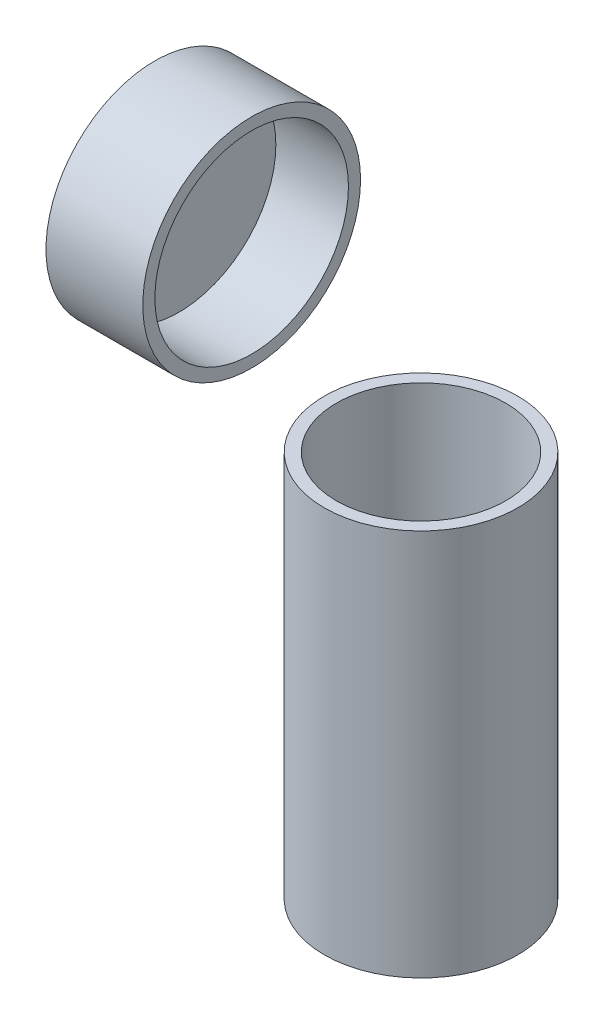
from build123d import *

# Parameters (mm, degrees)
SKETCH1_R           = 12.7
BOSS_EXTRUDE1_DEPTH = 50.8
SKETCH2_R           = 11.1125
CUT_EXTRUDE1_DEPTH  = 44.45
SKETCH3_R           = 14.2875
BOSS_EXTRUDE2_DEPTH = 12.7
SKETCH4_R           = 12.7
CUT_EXTRUDE2_DEPTH  = 9.525


with BuildPart() as part:
    # Sketch1 → Boss-Extrude1 (new body)
    with BuildSketch(Plane(origin=(0, 0, 0), x_dir=(1, 0, 0), z_dir=(0, 1, 0))):
        with Locations(Location((0, 0, 0), (0, 0, 270))):
            Circle(SKETCH1_R)
    extrude(amount=BOSS_EXTRUDE1_DEPTH)

    # Sketch2 → Cut-Extrude1 (cut)
    with BuildSketch(Plane(origin=(0, 50.8, 0), x_dir=(1, 0, 0), z_dir=(0, 1, 0))):
        with Locations(Location((0, 0, 0), (0, 0, 270))):
            Circle(SKETCH2_R)
    extrude(amount=-CUT_EXTRUDE1_DEPTH, mode=Mode.SUBTRACT)


with BuildPart() as body_2:
    # Sketch3 → Boss-Extrude2 (new body)
    with BuildSketch(Plane(origin=(-22.225, 0, 0), x_dir=(0, 0, -1), z_dir=(1, 0, 0))):
        with Locations((0, 63.5)):
            Circle(SKETCH3_R)
    extrude(amount=-BOSS_EXTRUDE2_DEPTH)

    # Sketch4 → Cut-Extrude2 (cut)
    with BuildSketch(Plane(origin=(-22.225, 0, 0), x_dir=(0, 0, -1), z_dir=(1, 0, 0))):
        with Locations((0, 63.5)):
            Circle(SKETCH4_R)
    extrude(amount=-CUT_EXTRUDE2_DEPTH, mode=Mode.SUBTRACT)


solid = Compound([part.part, body_2.part])
